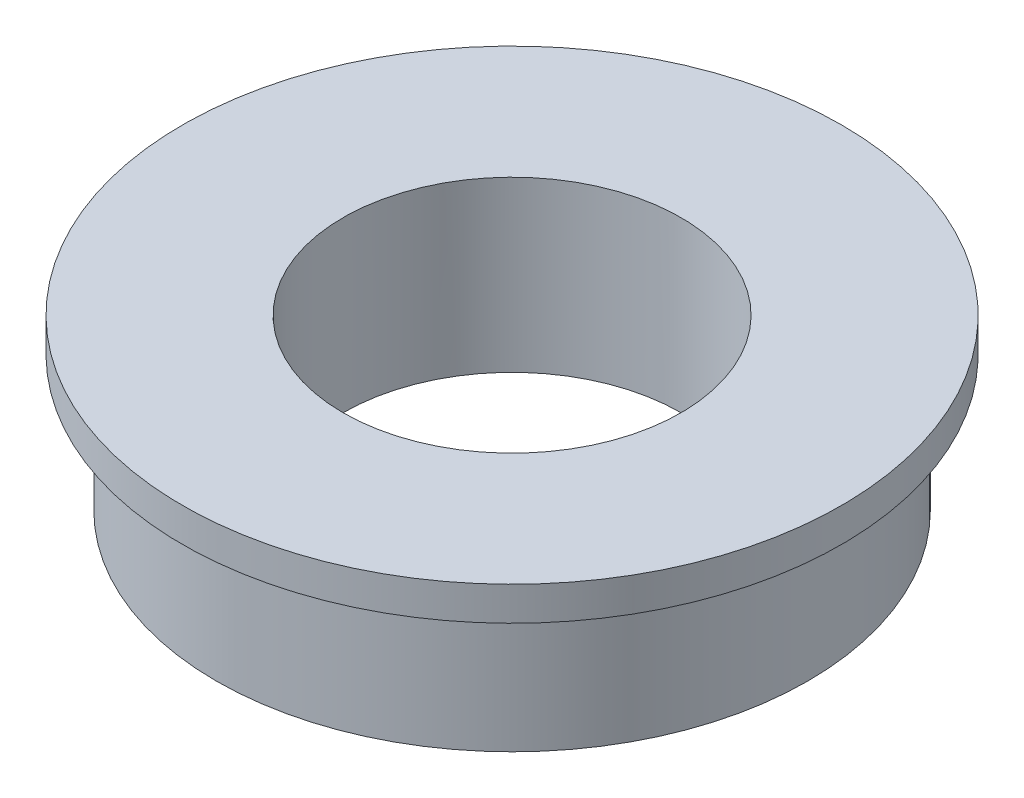
from build123d import *

# Parameters (mm, degrees)
CUT_EXTRUDE_1_REACH = 13.734
SKETCH_2_R          = 4


with BuildPart() as part:
    # 草图1 → 旋转1 (revolve)
    with BuildSketch(Plane.XY, mode=Mode.PRIVATE) as revolve_1_sk:
        Polygon((0, 4), (7.8, 4), (7.8, 3.2), (7, 3.2), (7, 0), (0, 0), align=None)
    revolve(revolve_1_sk.sketch.rotate(Axis((0, 0, 0), (0, 1, 0)), 90), axis=Axis((0, 0, 0), (0, 1, 0)))

    # 草图2 → 切除-拉伸1 (cut, up to next)
    with BuildSketch(Plane(origin=(0, 4, 0), x_dir=(1, 0, 0), z_dir=(0, 1, 0)), mode=Mode.PRIVATE) as cut_extrude_1_sk1:
        with Locations(Location((0, 0, 0), (0, 0, 270))):
            Circle(SKETCH_2_R)
    cut_extrude_1_tool1 = extrude(cut_extrude_1_sk1.sketch, amount=-CUT_EXTRUDE_1_REACH, mode=Mode.PRIVATE) & part.part
    add(cut_extrude_1_tool1.solids().sort_by_distance((0, 4, 0))[0], mode=Mode.SUBTRACT)


solid = part.part
